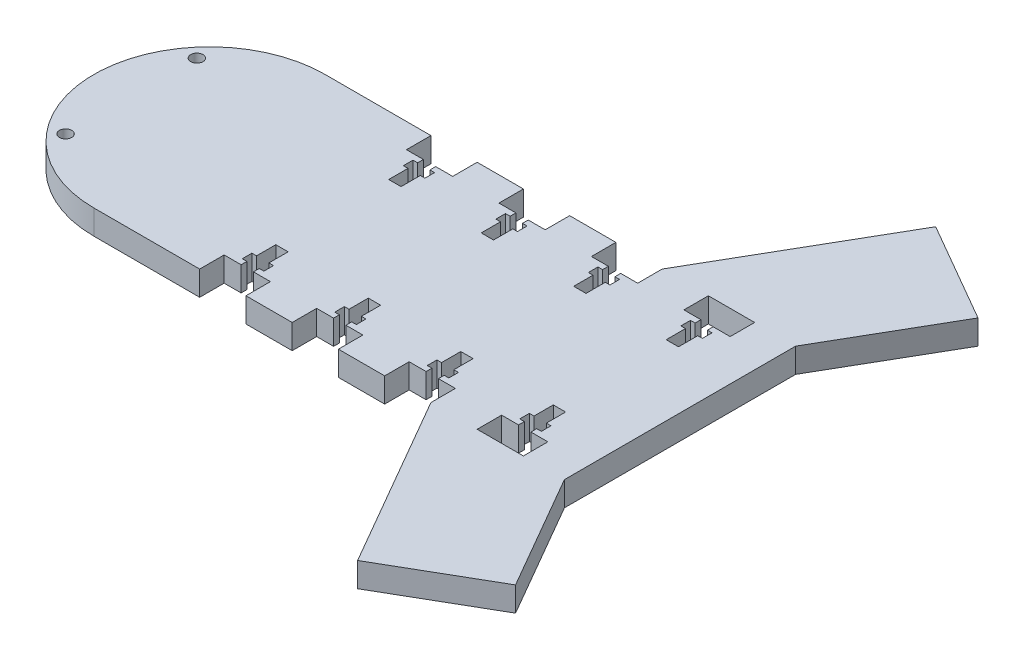
from build123d import *

# Parameters (mm, degrees)
BOSS_EXTRUDE1_DEPTH     = 6.35
CUT_EXTRUDE1_REACH      = 160.449
SKETCH2_W               = 12
SKETCH2_H               = 6.35
LPATTERN2_COUNT         = 3
LPATTERN2_PITCH         = 24
LPATTERN6_COUNT         = 2
LPATTERN6_PITCH         = 24
MIRROR5_COPY_1_REACH    = 160.449
MIRROR5_COPY_1_SKETCH_W = 12
MIRROR5_COPY_1_SKETCH_H = 6.35
MIRROR5_COPY_2_REACH    = 160.449
MIRROR5_COPY_2_SKETCH_W = 12
MIRROR5_COPY_2_SKETCH_H = 6.35
CUT_EXTRUDE2_REACH      = 160.449
SKETCH4_W               = 12
SKETCH4_H               = 6.35
CUT_EXTRUDE3_REACH      = 160.449
LPATTERN9_COUNT         = 4
LPATTERN9_PITCH         = 24
MIRROR14_COPY_1_REACH   = 160.449
MIRROR14_COPY_2_REACH   = 160.449
MIRROR14_COPY_3_REACH   = 160.449
CUT_EXTRUDE4_REACH      = 160.449
SKETCH6_R               = 1.6


with BuildPart() as part:
    # Sketch1 → Boss-Extrude1 (new body)
    with BuildSketch(Plane(origin=(0, 0, 0), x_dir=(1, 0, 0), z_dir=(0, 1, 0))):
        with BuildLine():
            Line((0, 30), (87.468983849, 30))
            Line((87.468983849, 30), (113.449745962, 75))
            Line((113.449745962, 75), (139.430508076, 60))
            Line((139.430508076, 60), (122.11, 30))
            Line((122.11, 30), (122.11, -30))
            Line((122.11, -30), (139.430508076, -60))
            Line((139.430508076, -60), (113.449745962, -75))
            Line((113.449745962, -75), (87.468983849, -30))
            Line((87.468983849, -30), (0, -30))
            ThreePointArc((0, -30), (-30, 0), (0, 30))
        make_face()
    extrude(amount=BOSS_EXTRUDE1_DEPTH)

    # Sketch2 → Cut-Extrude1 (cut, up to next)
    with BuildSketch(Plane(origin=(0, 6.35, 0), x_dir=(1, 0, 0), z_dir=(0, 1, 0)), mode=Mode.PRIVATE) as cut_extrude1_sk1:
        with Locations((81.468983849, 26.825)):
            Rectangle(SKETCH2_W, SKETCH2_H)
    cut_extrude1_tool1 = extrude(cut_extrude1_sk1.sketch, amount=-CUT_EXTRUDE1_REACH, mode=Mode.PRIVATE) & part.part
    cut_extrude1 = cut_extrude1_tool1.solids().sort_by_distance((81.468984, 6.35, -26.825))[0]
    add(cut_extrude1, mode=Mode.SUBTRACT)

    # LPattern2: Cut-Extrude1 ×3
    with Locations(*[(-i * LPATTERN2_PITCH, 0, 0) for i in range(1, LPATTERN2_COUNT)]):
        add(cut_extrude1, mode=Mode.SUBTRACT)

    # LPattern6: Cut-Extrude1 ×2
    with Locations(*[(i * LPATTERN6_PITCH, 0, 0) for i in range(1, LPATTERN6_COUNT)]):
        add(cut_extrude1, mode=Mode.SUBTRACT)

    # Mirror5: Cut-Extrude1 across plane
    add(cut_extrude1.mirror(Plane.XY), mode=Mode.SUBTRACT)

    # Mirror5 copy 1 sketch → Mirror5 copy 1 (cut, up to next)
    with BuildSketch(Plane(origin=(-24, 6.35, 0), x_dir=(1, 0, 0), z_dir=(0, 1, 0)), mode=Mode.PRIVATE) as mirror5_copy_1_sk1:
        with Locations((81.468983849, -26.825)):
            Rectangle(MIRROR5_COPY_1_SKETCH_W, MIRROR5_COPY_1_SKETCH_H)
    mirror5_copy_1_tool1 = extrude(mirror5_copy_1_sk1.sketch, amount=-MIRROR5_COPY_1_REACH, mode=Mode.PRIVATE) & part.part
    add(mirror5_copy_1_tool1.solids().sort_by_distance((57.468984, 6.35, 26.825))[0], mode=Mode.SUBTRACT)

    # Mirror5 copy 2 sketch → Mirror5 copy 2 (cut, up to next)
    with BuildSketch(Plane(origin=(-48, 6.35, 0), x_dir=(1, 0, 0), z_dir=(0, 1, 0)), mode=Mode.PRIVATE) as mirror5_copy_2_sk1:
        with Locations((81.468983849, -26.825)):
            Rectangle(MIRROR5_COPY_2_SKETCH_W, MIRROR5_COPY_2_SKETCH_H)
    mirror5_copy_2_tool1 = extrude(mirror5_copy_2_sk1.sketch, amount=-MIRROR5_COPY_2_REACH, mode=Mode.PRIVATE) & part.part
    add(mirror5_copy_2_tool1.solids().sort_by_distance((33.468984, 6.35, 26.825))[0], mode=Mode.SUBTRACT)

    # Sketch4 → Cut-Extrude2 (cut, up to next)
    with BuildSketch(Plane(origin=(0, 6.35, 0), x_dir=(1, 0, 0), z_dir=(0, 1, 0)), mode=Mode.PRIVATE) as cut_extrude2_sk1:
        with Locations((105.468983849, -26.825)):
            Rectangle(SKETCH4_W, SKETCH4_H)
    cut_extrude2_tool1 = extrude(cut_extrude2_sk1.sketch, amount=-CUT_EXTRUDE2_REACH, mode=Mode.PRIVATE) & part.part
    add(cut_extrude2_tool1.solids().sort_by_distance((105.468984, 6.35, 26.825))[0], mode=Mode.SUBTRACT)

    # Sketch5 → Cut-Extrude3 (cut, up to next)
    with BuildSketch(Plane(origin=(0, 6.35, 0), x_dir=(1, 0, 0), z_dir=(0, 1, 0)), mode=Mode.PRIVATE) as cut_extrude3_sk1:
        Polygon((31.868983849, 23.65), (31.868983849, 22.15), (30.668983849, 22.15), (30.668983849, 19.65), (31.868983849, 19.65), (31.868983849, 14.65), (35.068983849, 14.65), (35.068983849, 19.65), (36.268983849, 19.65), (36.268983849, 22.15), (35.068983849, 22.15), (35.068983849, 23.65), align=None)
    cut_extrude3_tool1 = extrude(cut_extrude3_sk1.sketch, amount=-CUT_EXTRUDE3_REACH, mode=Mode.PRIVATE) & part.part
    cut_extrude3 = cut_extrude3_tool1.solids().sort_by_distance((33.468984, 6.35, -19.451724))[0]
    add(cut_extrude3, mode=Mode.SUBTRACT)

    # LPattern9: Cut-Extrude3 ×4
    with Locations(*[(i * LPATTERN9_PITCH, 0, 0) for i in range(1, LPATTERN9_COUNT)]):
        add(cut_extrude3, mode=Mode.SUBTRACT)

    # Mirror14: Cut-Extrude3 across plane
    add(cut_extrude3.mirror(Plane.XY), mode=Mode.SUBTRACT)

    # Mirror14 copy 1 sketch → Mirror14 copy 1 (cut, up to next)
    with BuildSketch(Plane(origin=(24, 6.35, 0), x_dir=(1, 0, 0), z_dir=(0, 1, 0)), mode=Mode.PRIVATE) as mirror14_copy_1_sk1:
        Polygon((31.868983849, -23.65), (31.868983849, -22.15), (30.668983849, -22.15), (30.668983849, -19.65), (31.868983849, -19.65), (31.868983849, -14.65), (35.068983849, -14.65), (35.068983849, -19.65), (36.268983849, -19.65), (36.268983849, -22.15), (35.068983849, -22.15), (35.068983849, -23.65), align=None)
    mirror14_copy_1_tool1 = extrude(mirror14_copy_1_sk1.sketch, amount=-MIRROR14_COPY_1_REACH, mode=Mode.PRIVATE) & part.part
    add(mirror14_copy_1_tool1.solids().sort_by_distance((57.468984, 6.35, 19.451724))[0], mode=Mode.SUBTRACT)

    # Mirror14 copy 2 sketch → Mirror14 copy 2 (cut, up to next)
    with BuildSketch(Plane(origin=(48, 6.35, 0), x_dir=(1, 0, 0), z_dir=(0, 1, 0)), mode=Mode.PRIVATE) as mirror14_copy_2_sk1:
        Polygon((31.868983849, -23.65), (31.868983849, -22.15), (30.668983849, -22.15), (30.668983849, -19.65), (31.868983849, -19.65), (31.868983849, -14.65), (35.068983849, -14.65), (35.068983849, -19.65), (36.268983849, -19.65), (36.268983849, -22.15), (35.068983849, -22.15), (35.068983849, -23.65), align=None)
    mirror14_copy_2_tool1 = extrude(mirror14_copy_2_sk1.sketch, amount=-MIRROR14_COPY_2_REACH, mode=Mode.PRIVATE) & part.part
    add(mirror14_copy_2_tool1.solids().sort_by_distance((81.468984, 6.35, 19.451724))[0], mode=Mode.SUBTRACT)

    # Mirror14 copy 3 sketch → Mirror14 copy 3 (cut, up to next)
    with BuildSketch(Plane(origin=(72, 6.35, 0), x_dir=(1, 0, 0), z_dir=(0, 1, 0)), mode=Mode.PRIVATE) as mirror14_copy_3_sk1:
        Polygon((31.868983849, -23.65), (31.868983849, -22.15), (30.668983849, -22.15), (30.668983849, -19.65), (31.868983849, -19.65), (31.868983849, -14.65), (35.068983849, -14.65), (35.068983849, -19.65), (36.268983849, -19.65), (36.268983849, -22.15), (35.068983849, -22.15), (35.068983849, -23.65), align=None)
    mirror14_copy_3_tool1 = extrude(mirror14_copy_3_sk1.sketch, amount=-MIRROR14_COPY_3_REACH, mode=Mode.PRIVATE) & part.part
    add(mirror14_copy_3_tool1.solids().sort_by_distance((105.468984, 6.35, 19.451724))[0], mode=Mode.SUBTRACT)

    # Sketch6 → Cut-Extrude4 (cut, up to next)
    with BuildSketch(Plane(origin=(0, 6.35, 0), x_dir=(1, 0, 0), z_dir=(0, 1, 0)), mode=Mode.PRIVATE) as cut_extrude4_sk1:
        with Locations(Location((-20.300177743, -17.033871657, 0), (0, 0, 270))):
            Circle(SKETCH6_R)
    cut_extrude4_tool1 = extrude(cut_extrude4_sk1.sketch, amount=-CUT_EXTRUDE4_REACH, mode=Mode.PRIVATE) & part.part
    # Sketch6 → Cut-Extrude4 (cut, up to next)
    with BuildSketch(Plane(origin=(0, 6.35, 0), x_dir=(1, 0, 0), z_dir=(0, 1, 0)), mode=Mode.PRIVATE) as cut_extrude4_sk2:
        with Locations(Location((-20.300177743, 17.033871657, 0), (0, 0, 270))):
            Circle(SKETCH6_R)
    cut_extrude4_tool2 = extrude(cut_extrude4_sk2.sketch, amount=-CUT_EXTRUDE4_REACH, mode=Mode.PRIVATE) & part.part
    add(cut_extrude4_tool1.solids().sort_by_distance((-20.300178, 6.35, 17.033872))[0], mode=Mode.SUBTRACT)
    add(cut_extrude4_tool2.solids().sort_by_distance((-20.300178, 6.35, -17.033872))[0], mode=Mode.SUBTRACT)


solid = part.part
